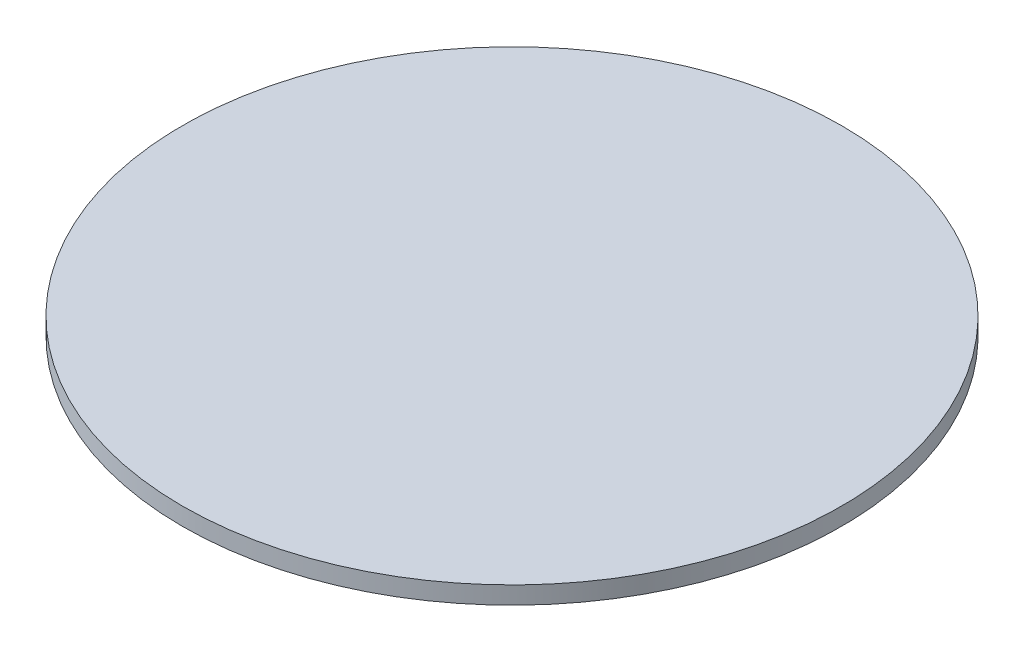
from build123d import *

# Parameters (mm, degrees)
SKETCH5_R           = 75
BOSS_EXTRUDE2_DEPTH = 4


with BuildPart() as part:
    # Sketch5 → Boss-Extrude2 (new body)
    with BuildSketch(Plane(origin=(0, 0, 0), x_dir=(1, 0, 0), z_dir=(0, 1, 0))):
        with Locations(Location((0, 0, 0), (0, 0, 270))):
            Circle(SKETCH5_R)
    extrude(amount=BOSS_EXTRUDE2_DEPTH)


solid = part.part
